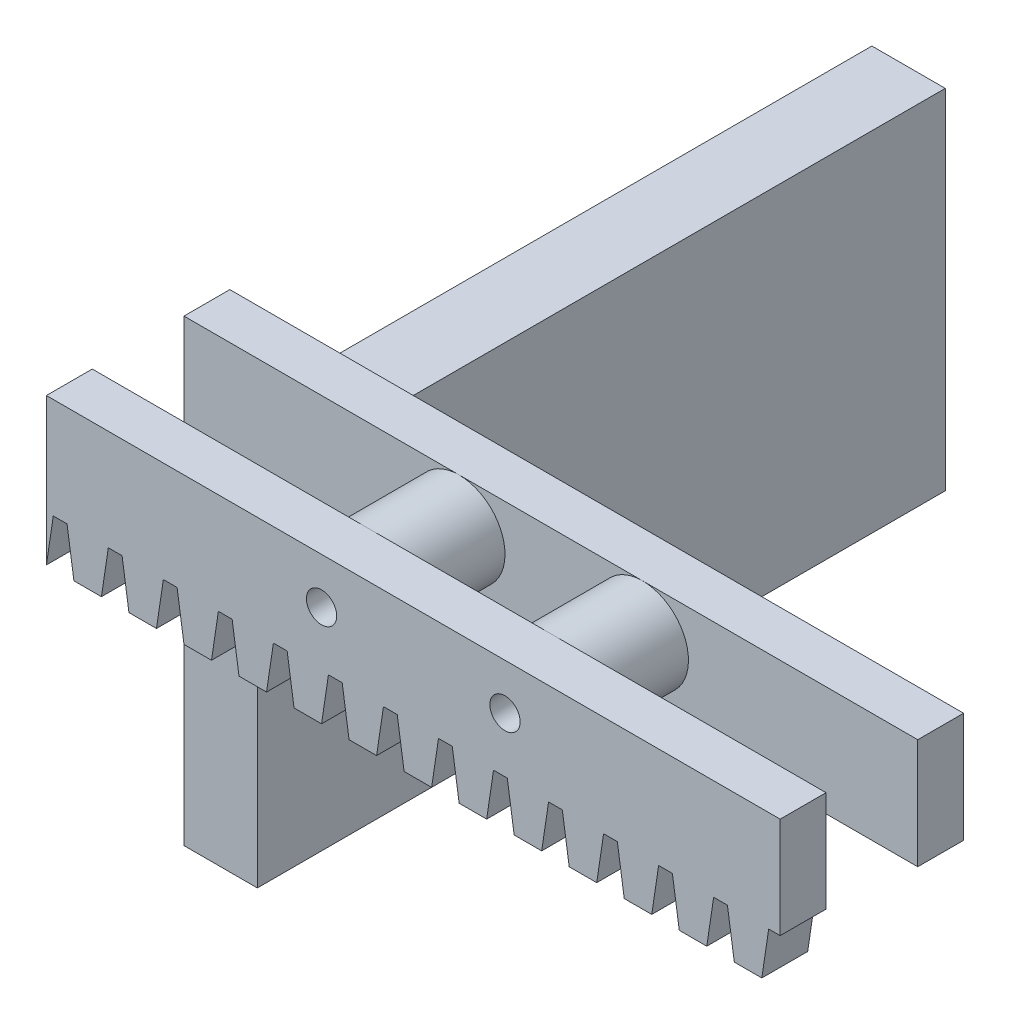
from build123d import *

# Parameters (mm, degrees)
SKETCH_1_W          = 80
SKETCH_1_H          = 16
EXTRUDE_1_DEPTH     = 5
CUT_EXTRUDE_1_REACH = 83.737
CUT_EXTRUDE_2_REACH = 83.737
SKETCH_3_R          = 1.65
SKETCH_4_R          = 5
SKETCH_4_R_2        = 1.65
EXTRUDE_2_DEPTH     = 10
EXTRUDE_2_2_DEPTH   = 10
SKETCH_5_W          = 80
SKETCH_5_H          = 12
EXTRUDE_3_DEPTH     = 5
SKETCH_6_W          = 8
SKETCH_6_H          = 50
EXTRUDE_4_DEPTH     = 5
SKETCH_7_W          = 8
SKETCH_7_H          = 38
EXTRUDE_5_DEPTH     = 70


with BuildPart() as part:
    # ｽｹｯﾁ1 → ﾎﾞｽ - 押し出し1 (new body)
    with BuildSketch(Plane.XY):
        with Locations((40, 8)):
            Rectangle(SKETCH_1_W, SKETCH_1_H)
    extrude(amount=EXTRUDE_1_DEPTH)

    # ｽｹｯﾁ2 → ｶｯﾄ - 押し出し1 (cut, up to next)
    with BuildSketch(Plane.XY.offset(5), mode=Mode.PRIVATE) as cut_extrude_1_sk1:
        Polygon((0, 0), (0.75, 5), (2.25, 5), (3, 0), align=None)
    cut_extrude_1_tool1 = extrude(cut_extrude_1_sk1.sketch, amount=-CUT_EXTRUDE_1_REACH, mode=Mode.PRIVATE) & part.part
    # ｽｹｯﾁ2 → ｶｯﾄ - 押し出し1 (cut, up to next)
    with BuildSketch(Plane.XY.offset(5), mode=Mode.PRIVATE) as cut_extrude_1_sk2:
        Polygon((6, 0), (9, 0), (8.25, 5), (6.75, 5), align=None)
    cut_extrude_1_tool2 = extrude(cut_extrude_1_sk2.sketch, amount=-CUT_EXTRUDE_1_REACH, mode=Mode.PRIVATE) & part.part
    # ｽｹｯﾁ2 → ｶｯﾄ - 押し出し1 (cut, up to next)
    with BuildSketch(Plane.XY.offset(5), mode=Mode.PRIVATE) as cut_extrude_1_sk3:
        Polygon((12, 0), (15, 0), (14.25, 5), (12.75, 5), align=None)
    cut_extrude_1_tool3 = extrude(cut_extrude_1_sk3.sketch, amount=-CUT_EXTRUDE_1_REACH, mode=Mode.PRIVATE) & part.part
    # ｽｹｯﾁ2 → ｶｯﾄ - 押し出し1 (cut, up to next)
    with BuildSketch(Plane.XY.offset(5), mode=Mode.PRIVATE) as cut_extrude_1_sk4:
        Polygon((18, 0), (21, 0), (20.25, 5), (18.75, 5), align=None)
    cut_extrude_1_tool4 = extrude(cut_extrude_1_sk4.sketch, amount=-CUT_EXTRUDE_1_REACH, mode=Mode.PRIVATE) & part.part
    # ｽｹｯﾁ2 → ｶｯﾄ - 押し出し1 (cut, up to next)
    with BuildSketch(Plane.XY.offset(5), mode=Mode.PRIVATE) as cut_extrude_1_sk5:
        Polygon((24, 0), (27, 0), (26.25, 5), (24.75, 5), align=None)
    cut_extrude_1_tool5 = extrude(cut_extrude_1_sk5.sketch, amount=-CUT_EXTRUDE_1_REACH, mode=Mode.PRIVATE) & part.part
    # ｽｹｯﾁ2 → ｶｯﾄ - 押し出し1 (cut, up to next)
    with BuildSketch(Plane.XY.offset(5), mode=Mode.PRIVATE) as cut_extrude_1_sk6:
        Polygon((30, 0), (33, 0), (32.25, 5), (30.75, 5), align=None)
    cut_extrude_1_tool6 = extrude(cut_extrude_1_sk6.sketch, amount=-CUT_EXTRUDE_1_REACH, mode=Mode.PRIVATE) & part.part
    # ｽｹｯﾁ2 → ｶｯﾄ - 押し出し1 (cut, up to next)
    with BuildSketch(Plane.XY.offset(5), mode=Mode.PRIVATE) as cut_extrude_1_sk7:
        Polygon((36, 0), (39, 0), (38.25, 5), (36.75, 5), align=None)
    cut_extrude_1_tool7 = extrude(cut_extrude_1_sk7.sketch, amount=-CUT_EXTRUDE_1_REACH, mode=Mode.PRIVATE) & part.part
    # ｽｹｯﾁ2 → ｶｯﾄ - 押し出し1 (cut, up to next)
    with BuildSketch(Plane.XY.offset(5), mode=Mode.PRIVATE) as cut_extrude_1_sk8:
        Polygon((42, 0), (45, 0), (44.25, 5), (42.75, 5), align=None)
    cut_extrude_1_tool8 = extrude(cut_extrude_1_sk8.sketch, amount=-CUT_EXTRUDE_1_REACH, mode=Mode.PRIVATE) & part.part
    # ｽｹｯﾁ2 → ｶｯﾄ - 押し出し1 (cut, up to next)
    with BuildSketch(Plane.XY.offset(5), mode=Mode.PRIVATE) as cut_extrude_1_sk9:
        Polygon((48, 0), (51, 0), (50.25, 5), (48.75, 5), align=None)
    cut_extrude_1_tool9 = extrude(cut_extrude_1_sk9.sketch, amount=-CUT_EXTRUDE_1_REACH, mode=Mode.PRIVATE) & part.part
    # ｽｹｯﾁ2 → ｶｯﾄ - 押し出し1 (cut, up to next)
    with BuildSketch(Plane.XY.offset(5), mode=Mode.PRIVATE) as cut_extrude_1_sk10:
        Polygon((54, 0), (57, 0), (56.25, 5), (54.75, 5), align=None)
    cut_extrude_1_tool10 = extrude(cut_extrude_1_sk10.sketch, amount=-CUT_EXTRUDE_1_REACH, mode=Mode.PRIVATE) & part.part
    # ｽｹｯﾁ2 → ｶｯﾄ - 押し出し1 (cut, up to next)
    with BuildSketch(Plane.XY.offset(5), mode=Mode.PRIVATE) as cut_extrude_1_sk11:
        Polygon((60, 0), (63, 0), (62.25, 5), (60.75, 5), align=None)
    cut_extrude_1_tool11 = extrude(cut_extrude_1_sk11.sketch, amount=-CUT_EXTRUDE_1_REACH, mode=Mode.PRIVATE) & part.part
    # ｽｹｯﾁ2 → ｶｯﾄ - 押し出し1 (cut, up to next)
    with BuildSketch(Plane.XY.offset(5), mode=Mode.PRIVATE) as cut_extrude_1_sk12:
        Polygon((66, 0), (69, 0), (68.25, 5), (66.75, 5), align=None)
    cut_extrude_1_tool12 = extrude(cut_extrude_1_sk12.sketch, amount=-CUT_EXTRUDE_1_REACH, mode=Mode.PRIVATE) & part.part
    # ｽｹｯﾁ2 → ｶｯﾄ - 押し出し1 (cut, up to next)
    with BuildSketch(Plane.XY.offset(5), mode=Mode.PRIVATE) as cut_extrude_1_sk13:
        Polygon((72, 0), (75, 0), (74.25, 5), (72.75, 5), align=None)
    cut_extrude_1_tool13 = extrude(cut_extrude_1_sk13.sketch, amount=-CUT_EXTRUDE_1_REACH, mode=Mode.PRIVATE) & part.part
    # ｽｹｯﾁ2 → ｶｯﾄ - 押し出し1 (cut, up to next)
    with BuildSketch(Plane.XY.offset(5), mode=Mode.PRIVATE) as cut_extrude_1_sk14:
        Polygon((78, 0), (81, 0), (80.25, 5), (78.75, 5), align=None)
    cut_extrude_1_tool14 = extrude(cut_extrude_1_sk14.sketch, amount=-CUT_EXTRUDE_1_REACH, mode=Mode.PRIVATE) & part.part
    add(cut_extrude_1_tool1.solids().sort_by_distance((1.5, 2.222222, 5))[0], mode=Mode.SUBTRACT)
    add(cut_extrude_1_tool2.solids().sort_by_distance((7.5, 2.222222, 5))[0], mode=Mode.SUBTRACT)
    add(cut_extrude_1_tool3.solids().sort_by_distance((13.5, 2.222222, 5))[0], mode=Mode.SUBTRACT)
    add(cut_extrude_1_tool4.solids().sort_by_distance((19.5, 2.222222, 5))[0], mode=Mode.SUBTRACT)
    add(cut_extrude_1_tool5.solids().sort_by_distance((25.5, 2.222222, 5))[0], mode=Mode.SUBTRACT)
    add(cut_extrude_1_tool6.solids().sort_by_distance((31.5, 2.222222, 5))[0], mode=Mode.SUBTRACT)
    add(cut_extrude_1_tool7.solids().sort_by_distance((37.5, 2.222222, 5))[0], mode=Mode.SUBTRACT)
    add(cut_extrude_1_tool8.solids().sort_by_distance((43.5, 2.222222, 5))[0], mode=Mode.SUBTRACT)
    add(cut_extrude_1_tool9.solids().sort_by_distance((49.5, 2.222222, 5))[0], mode=Mode.SUBTRACT)
    add(cut_extrude_1_tool10.solids().sort_by_distance((55.5, 2.222222, 5))[0], mode=Mode.SUBTRACT)
    add(cut_extrude_1_tool11.solids().sort_by_distance((61.5, 2.222222, 5))[0], mode=Mode.SUBTRACT)
    add(cut_extrude_1_tool12.solids().sort_by_distance((67.5, 2.222222, 5))[0], mode=Mode.SUBTRACT)
    add(cut_extrude_1_tool13.solids().sort_by_distance((73.5, 2.222222, 5))[0], mode=Mode.SUBTRACT)
    add(cut_extrude_1_tool14.solids().sort_by_distance((79.5, 2.222222, 5))[0], mode=Mode.SUBTRACT)

    # ｽｹｯﾁ3 → ｶｯﾄ - 押し出し2 (cut, up to next)
    with BuildSketch(Plane.XY.offset(5), mode=Mode.PRIVATE) as cut_extrude_2_sk1:
        with Locations((30, 11)):
            Circle(SKETCH_3_R)
    cut_extrude_2_tool1 = extrude(cut_extrude_2_sk1.sketch, amount=-CUT_EXTRUDE_2_REACH, mode=Mode.PRIVATE) & part.part
    # ｽｹｯﾁ3 → ｶｯﾄ - 押し出し2 (cut, up to next)
    with BuildSketch(Plane.XY.offset(5), mode=Mode.PRIVATE) as cut_extrude_2_sk2:
        with Locations((50, 11)):
            Circle(SKETCH_3_R)
    cut_extrude_2_tool2 = extrude(cut_extrude_2_sk2.sketch, amount=-CUT_EXTRUDE_2_REACH, mode=Mode.PRIVATE) & part.part
    add(cut_extrude_2_tool1.solids().sort_by_distance((30, 11, 5))[0], mode=Mode.SUBTRACT)
    add(cut_extrude_2_tool2.solids().sort_by_distance((50, 11, 5))[0], mode=Mode.SUBTRACT)


with BuildPart() as body_2:
    # ｽｹｯﾁ4 → ﾎﾞｽ - 押し出し2 (new body)
    with BuildSketch(Plane(origin=(0, 0, 0), x_dir=(-1, 0, 0), z_dir=(0, 0, -1))):
        with Locations((-50, 11)):
            Circle(SKETCH_4_R)
        with Locations((-50, 11)):
            Circle(SKETCH_4_R_2, mode=Mode.SUBTRACT)
    extrude(amount=EXTRUDE_2_DEPTH)



with BuildPart() as body_3:
    # ｽｹｯﾁ4 → Extrude 2 2 (new body)
    with BuildSketch(Plane(origin=(0, 0, 0), x_dir=(-1, 0, 0), z_dir=(0, 0, -1))):
        with Locations((-30, 11)):
            Circle(SKETCH_4_R)
        with Locations(Location((-30, 11, 0), (0, 0, 180))):
            Circle(SKETCH_4_R_2, mode=Mode.SUBTRACT)
    extrude(amount=EXTRUDE_2_2_DEPTH)


with BuildPart() as body_2_1:
    add(body_2.part)

    add(body_3.part)  # ﾎﾞｽ - 押し出し3 merges body 3
    # ｽｹｯﾁ5 → ﾎﾞｽ - 押し出し3 (add)
    with BuildSketch(Plane(origin=(0, 0, -10), x_dir=(-1, 0, 0), z_dir=(0, 0, -1))):
        with Locations((-40, 10)):
            Rectangle(SKETCH_5_W, SKETCH_5_H)
    extrude(amount=EXTRUDE_3_DEPTH)

    # ｽｹｯﾁ6 → ﾎﾞｽ - 押し出し4 (add)
    with BuildSketch(Plane(origin=(0, 0, -15), x_dir=(-1, 0, 0), z_dir=(0, 0, -1))):
        with Locations((-4, -9)):
            Rectangle(SKETCH_6_W, SKETCH_6_H)
    extrude(amount=-EXTRUDE_4_DEPTH)

    # ｽｹｯﾁ7 → ﾎﾞｽ - 押し出し5 (add)
    with BuildSketch(Plane(origin=(0, 0, -15), x_dir=(-1, 0, 0), z_dir=(0, 0, -1))):
        with Locations((-4, -15)):
            Rectangle(SKETCH_7_W, SKETCH_7_H)
    extrude(amount=EXTRUDE_5_DEPTH)


solid = Compound([part.part, body_2_1.part])
